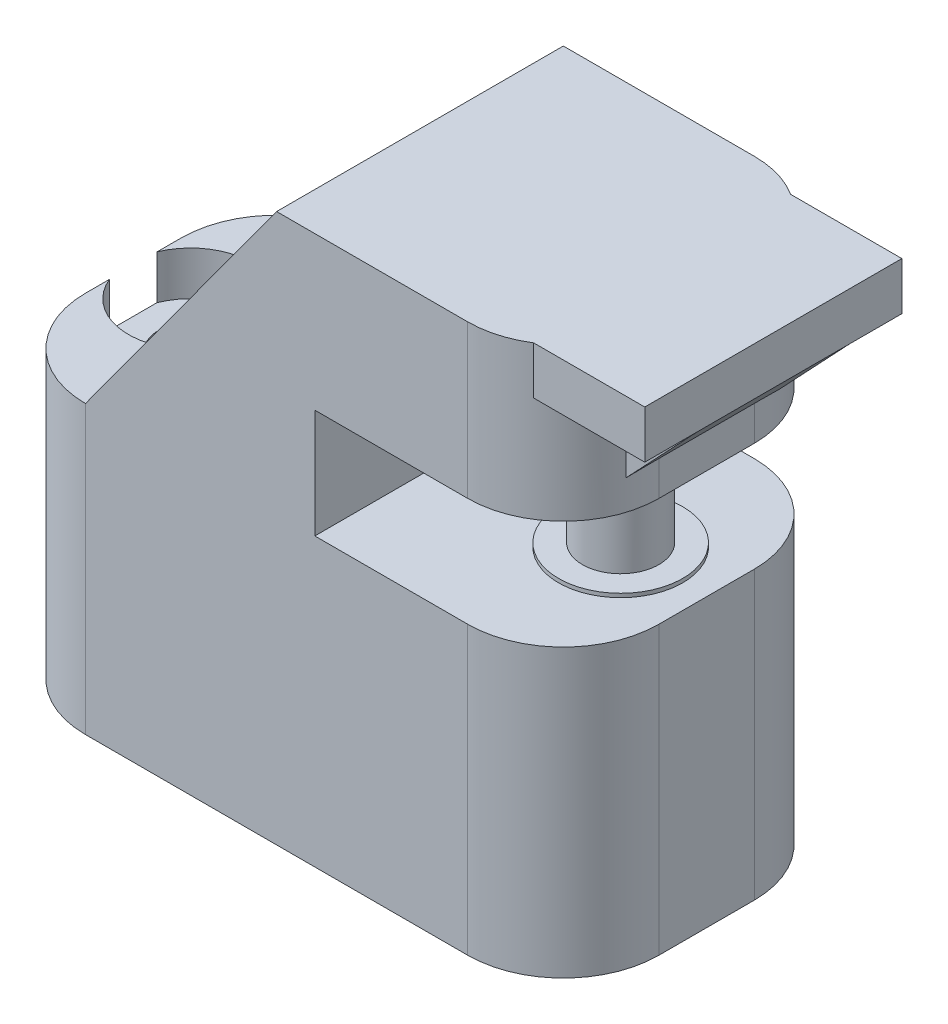
from build123d import *

# Parameters (mm, degrees)
BOSS_EXTRUDE1_DEPTH           = 15
BOSS_EXTRUDE2_REACH           = 38.742
SKETCH3_R                     = 2
SKETCH4_R                     = 3.25
BOSS_EXTRUDE3_DEPTH           = 0.2
FILLET1_R                     = 5
CBORE_FOR_M3_SHCS1_AT_2_COUNT = 2
CBORE_FOR_M3_SHCS1_AT_2_PITCH = 7
SKETCH7_W                     = 5.814312221
SKETCH7_H                     = 13.45156011
BOSS_EXTRUDE4_DEPTH           = 2.5
RIB1_REACH                    = 46.736
SKETCH9_WALL_W                = 96.550792296
SKETCH9_WALL_H                = 8


with BuildPart() as part:
    # Sketch1 → Boss-Extrude1 (new body)
    with BuildSketch(Plane.XY):
        Polygon((0, 0), (0, 15), (5, 15), (15, 28.7), (30, 28.7), (30, 20.7), (17, 20.7), (17, 15), (30, 15), (30, 0), align=None)
    extrude(amount=BOSS_EXTRUDE1_DEPTH)

    # Sketch3 → Boss-Extrude2 (add, up to next)
    with BuildSketch(Plane(origin=(0, 15, 0), x_dir=(1, 0, 0), z_dir=(0, 1, 0)), mode=Mode.PRIVATE) as boss_extrude2_sk1:
        with Locations(Location((25.5, -7.5, 0), (0, 0, 90))):
            Circle(SKETCH3_R)
    boss_extrude2_tool1 = extrude(boss_extrude2_sk1.sketch, amount=BOSS_EXTRUDE2_REACH, mode=Mode.PRIVATE) - part.part
    add(boss_extrude2_tool1.solids().sort_by_distance((25.5, 15, 7.5))[0])

    # Sketch4 → Boss-Extrude3 (add)
    with BuildSketch(Plane(origin=(0, 15, 0), x_dir=(1, 0, 0), z_dir=(0, 1, 0))):
        with Locations(Location((25.5, -7.5, 0), (0, 0, 90))):
            Circle(SKETCH4_R)
    boss_extrude3 = extrude(amount=BOSS_EXTRUDE3_DEPTH)

    # Mirror1: Boss-Extrude3 across plane
    add(boss_extrude3.mirror(Plane.ZX.offset(17.85)))

    # Fillet1
    fillet1_edges = [part.edges().sort_by_distance(p)[0] for p in [
        (0, 7.5, 0),
        (30, 24.7, 0),
        (30, 7.5, 0),
        (30, 24.7, 15),
        (0, 7.5, 15),
        (30, 7.5, 15),
    ]]
    fillet(fillet1_edges, radius=FILLET1_R)

    # Sketch6 → CBORE for M3 SHCS1 (revolve, cut)
    with BuildSketch(Plane(origin=(3, 28.7, 7.5), x_dir=(0, 0, 1), z_dir=(1, 0, 0))):
        Polygon((0, 0), (0, 28.7), (1.7, 28.7), (1.7, 16), (3.25, 16), (3.25, 0.025), (3.275, 0), align=None)
    cbore_for_m3_shcs1 = revolve(axis=Axis((3, 35.05, 7.5), (0, -1, 0)), mode=Mode.SUBTRACT)

    # CBORE for M3 SHCS1 at 2: CBORE for M3 SHCS1 ×2
    with Locations(*[(i * CBORE_FOR_M3_SHCS1_AT_2_PITCH, 0, 0) for i in range(1, CBORE_FOR_M3_SHCS1_AT_2_COUNT)]):
        add(cbore_for_m3_shcs1, mode=Mode.SUBTRACT)

    # Sketch7 → Boss-Extrude4 (add)
    with BuildSketch(Plane(origin=(0, 28.7, 0), x_dir=(1, 0, 0), z_dir=(0, 1, 0))):
        with Locations((30.579754646, -7.5)):
            Rectangle(SKETCH7_W, SKETCH7_H)
    extrude(amount=-BOSS_EXTRUDE4_DEPTH)

    # Sketch9 wall → Rib1 (add, up to next)
    with BuildSketch(Plane(origin=(31.743455378, 24.353734121, 7.5), x_dir=(-0.686573540745, -0.727060364171, 0), z_dir=(0.727060364171, -0.686573540745, 0)), mode=Mode.PRIVATE) as rib1_sk1:
        Rectangle(SKETCH9_WALL_W, SKETCH9_WALL_H)
    rib1_tool1 = extrude(rib1_sk1.sketch, amount=-RIB1_REACH, mode=Mode.PRIVATE) - part.part
    add(rib1_tool1.solids().sort_by_distance((31.743455378, 24.353734121, 7.5))[0])


solid = part.part
